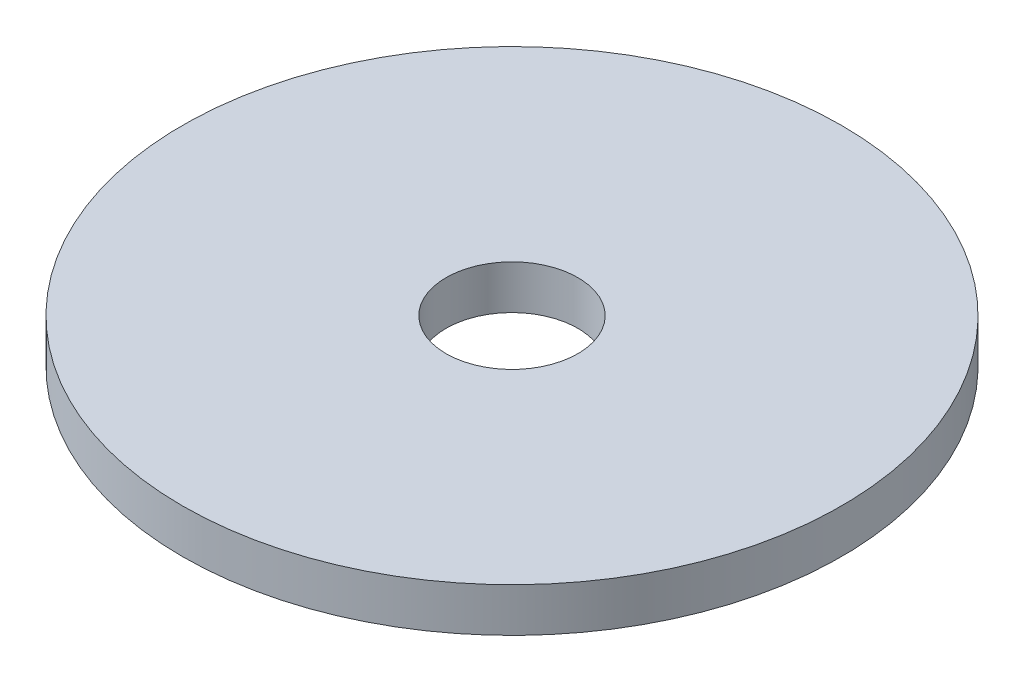
from build123d import *

# Parameters (mm, degrees)
SKETCH1_R           = 7.5
SKETCH1_R_2         = 1.5
BOSS_EXTRUDE1_DEPTH = 1


with BuildPart() as part:
    # Sketch1 → Boss-Extrude1 (new body)
    with BuildSketch(Plane(origin=(0, 0, 0), x_dir=(1, 0, 0), z_dir=(0, 1, 0))):
        with Locations(Location((0, 0, 0), (0, 0, 270))):
            Circle(SKETCH1_R)
        with Locations(Location((0, 0, 0), (0, 0, 270))):
            Circle(SKETCH1_R_2, mode=Mode.SUBTRACT)
    extrude(amount=BOSS_EXTRUDE1_DEPTH)


solid = part.part
